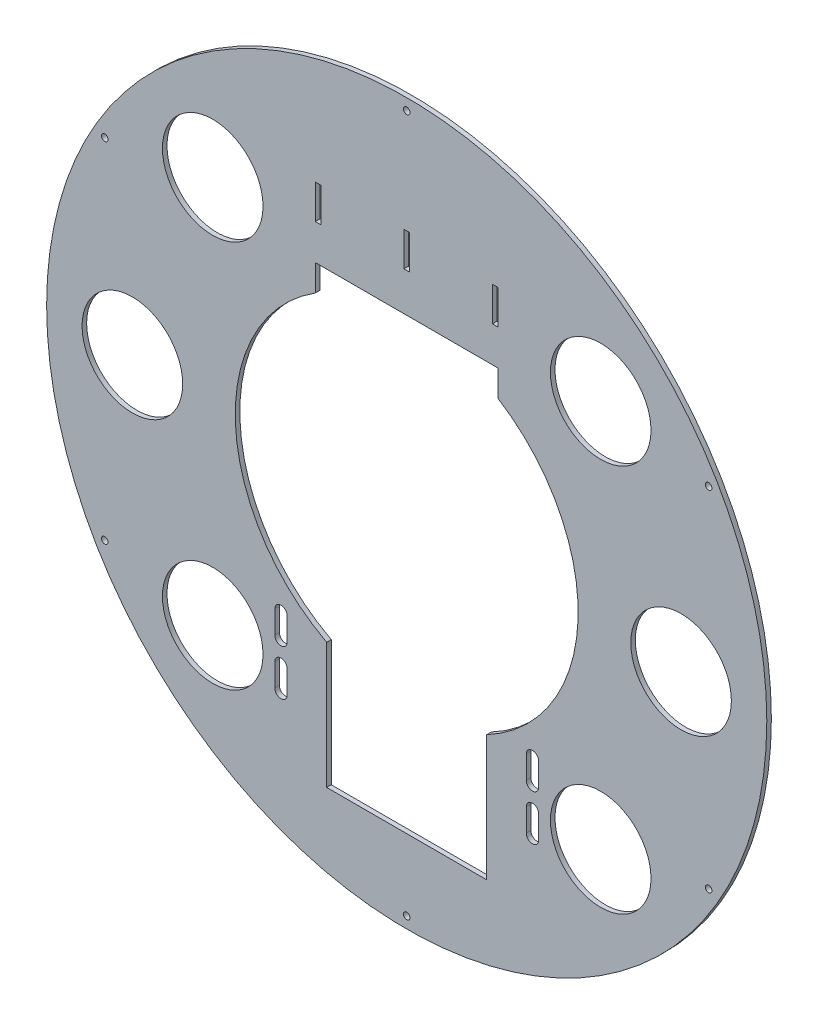
from build123d import *

# Parameters (mm, degrees)
BOSS_EXTRUDE1_DEPTH = 2.54
SKETCH5_W           = 3.175
SKETCH5_H           = 19.05
CUT_EXTRUDE1_DEPTH  = 3.175
SKETCH6_R           = 27.938087672
CUT_EXTRUDE2_DEPTH  = 3.175


with BuildPart() as part:
    # Sketch2 → Boss-Extrude1 (new body)
    with BuildSketch(Plane.XY):
        with BuildLine():
            ThreePointArc((0, -200.025), (200.025, 0), (0, 200.025))
            ThreePointArc((0, 200.025), (-200.025, 0), (0, -200.025))
        make_face()
        with BuildLine():
            ThreePointArc((-73.279, -107.95), (-69.85, -104.521), (-66.421, -107.95))
            Line((-66.421, -107.95), (-66.421, -120.65))
            ThreePointArc((-66.421, -120.65), (-69.85, -124.079), (-73.279, -120.65))
            Line((-73.279, -120.65), (-73.279, -107.95))
        make_face(mode=Mode.SUBTRACT)
        with BuildLine():
            ThreePointArc((-167.810051257, -95.021689383), (-165.911659461, -96.754918821), (-167.644888899, -98.653310617))
            ThreePointArc((-167.644888899, -98.653310617), (-169.543280695, -96.920081179), (-167.810051257, -95.021689383))
        make_face(mode=Mode.SUBTRACT)
        with BuildLine():
            ThreePointArc((-73.279, -82.55), (-69.85, -79.121), (-66.421, -82.55))
            Line((-66.421, -82.55), (-66.421, -95.25))
            ThreePointArc((-66.421, -95.25), (-69.85, -98.679), (-73.279, -95.25))
            Line((-73.279, -95.25), (-73.279, -82.55))
        make_face(mode=Mode.SUBTRACT)
        with BuildLine():
            ThreePointArc((-1.613828712, -192.83861209), (0.83638791, -192.061171288), (1.613828712, -194.51138791))
            ThreePointArc((1.613828712, -194.51138791), (-0.83638791, -195.288828712), (-1.613828712, -192.83861209))
        make_face(mode=Mode.SUBTRACT)
        with BuildLine():
            ThreePointArc((66.421, -107.95), (69.85, -104.521), (73.279, -107.95))
            Line((73.279, -107.95), (73.279, -120.65))
            ThreePointArc((73.279, -120.65), (69.85, -124.079), (66.421, -120.65))
            Line((66.421, -120.65), (66.421, -107.95))
        make_face(mode=Mode.SUBTRACT)
        with BuildLine():
            ThreePointArc((66.421, -82.55), (69.85, -79.121), (73.279, -82.55))
            Line((73.279, -82.55), (73.279, -95.25))
            ThreePointArc((73.279, -95.25), (69.85, -98.679), (66.421, -95.25))
            Line((66.421, -95.25), (66.421, -82.55))
        make_face(mode=Mode.SUBTRACT)
        with BuildLine():
            Line((-44.45, -154.092269675), (-44.45, -84.242269675))
            ThreePointArc((-44.45, -84.242269675), (-95.179383339, -3.667081567), (-50.8, 80.572467382))
            Line((-50.8, 80.572467382), (-50.8, 95.25))
            Line((-50.8, 95.25), (2.71e-07, 95.25))
            Line((2.71e-07, 95.25), (50.8, 95.25))
            Line((50.8, 95.25), (50.8, 80.572467382))
            ThreePointArc((50.8, 80.572467382), (83.400427157, 46.010121169), (95.25, 0))
            ThreePointArc((95.25, 0), (81.567226875, -49.186888497), (44.45, -84.242269675))
            Line((44.45, -84.242269675), (44.45, -154.092269675))
            Line((44.45, -154.092269675), (-44.45, -154.092269675))
        make_face(mode=Mode.SUBTRACT)
        with BuildLine():
            ThreePointArc((166.196222545, -97.816922707), (166.748047371, -95.306252467), (169.258717611, -95.858077293))
            ThreePointArc((169.258717611, -95.858077293), (168.706892785, -98.368747533), (166.196222545, -97.816922707))
        make_face(mode=Mode.SUBTRACT)
        with BuildLine():
            ThreePointArc((-166.196222545, 97.816922707), (-166.748047371, 95.306252467), (-169.258717611, 95.858077293))
            ThreePointArc((-169.258717611, 95.858077293), (-168.706892785, 98.368747533), (-166.196222545, 97.816922707))
        make_face(mode=Mode.SUBTRACT)
        with BuildLine():
            ThreePointArc((1.613828712, 192.83861209), (-0.83638791, 192.061171288), (-1.613828712, 194.51138791))
            ThreePointArc((-1.613828712, 194.51138791), (0.83638791, 195.288828712), (1.613828712, 192.83861209))
        make_face(mode=Mode.SUBTRACT)
        with BuildLine():
            ThreePointArc((167.810051257, 95.021689383), (165.911659461, 96.754918821), (167.644888899, 98.653310617))
            ThreePointArc((167.644888899, 98.653310617), (169.543280695, 96.920081179), (167.810051257, 95.021689383))
        make_face(mode=Mode.SUBTRACT)
    extrude(amount=BOSS_EXTRUDE1_DEPTH)

    # Sketch5 → Cut-Extrude1 (cut)
    with BuildSketch(Plane(origin=(0, 0, 0), x_dir=(-1, 0, 0), z_dir=(0, 0, -1))):
        with Locations((49.2125, 124.476608207)):
            Rectangle(SKETCH5_W, SKETCH5_H)
        with Locations((0, 126.364925979)):
            Rectangle(SKETCH5_W, SKETCH5_H)
        with Locations((-49.2125, 124.476608207)):
            Rectangle(SKETCH5_W, SKETCH5_H)
    extrude(amount=-CUT_EXTRUDE1_DEPTH, mode=Mode.SUBTRACT)

    # Sketch6 → Cut-Extrude2 (cut)
    with BuildSketch(Plane(origin=(0, 0, 0), x_dir=(-1, 0, 0), z_dir=(0, 0, -1))):
        with Locations((-152.4, 0)):
            Circle(SKETCH6_R)
        with Locations((-107.763073453, 107.763073453)):
            Circle(SKETCH6_R)
        with Locations((107.763073453, 107.763073453)):
            Circle(SKETCH6_R)
        with Locations((152.4, 0)):
            Circle(SKETCH6_R)
        with Locations((107.763073453, -107.763073453)):
            Circle(SKETCH6_R)
        with Locations((-107.763073453, -107.763073453)):
            Circle(SKETCH6_R)
    extrude(amount=-CUT_EXTRUDE2_DEPTH, mode=Mode.SUBTRACT)


solid = part.part
